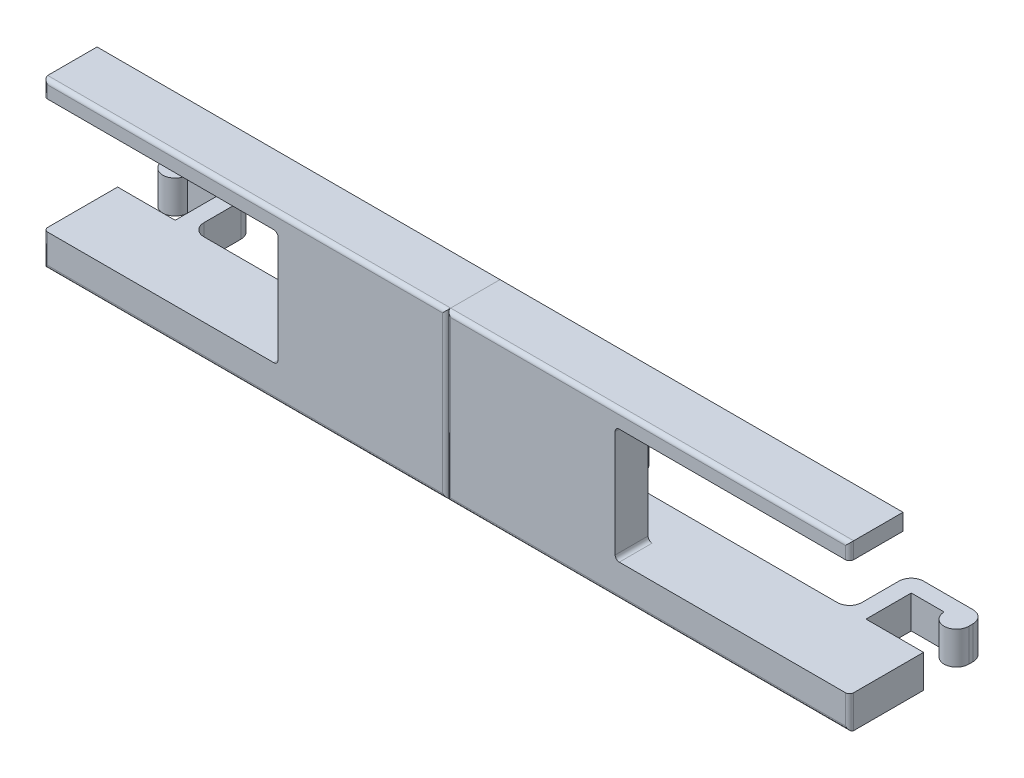
from build123d import *

# Parameters (mm, degrees)
EXTRUDE_1_DEPTH = 4
FILLET_1_R      = 1.5
EXTRUDE_2_DEPTH = 14
SKETCH_3_W      = 49
SKETCH_3_H      = 6.5
EXTRUDE_3_DEPTH = 2
FILLET_2_R      = 0.5
FILLET_3_R      = 1.5


with BuildPart() as part:
    # 草图1 → 凸台-拉伸1 (new body)
    with BuildSketch(Plane(origin=(0, 0, 0), x_dir=(1, 0, 0), z_dir=(0, 1, 0))):
        with BuildLine():
            Line((-34.254247299, 7.776879268), (-41.254247299, 7.776879268))
            Line((-41.254247299, 7.776879268), (-41.254247299, -1.223120732))
            Line((-41.254247299, -1.223120732), (7.745752701, -1.223120732))
            Line((7.745752701, -1.223120732), (7.745752701, 7.776879268))
            Line((7.745752701, 7.776879268), (7.745752701, 12.776879268))
            Line((7.745752701, 12.776879268), (7.745752701, 15.276879268))
            Line((7.745752701, 15.276879268), (5.745752701, 15.276879268))
            Line((5.745752701, 15.276879268), (-1.254247299, 15.276879268))
            Line((-1.254247299, 15.276879268), (-1.254247299, 13.276879268))
            ThreePointArc((-1.254247299, 13.276879268), (0.245752701, 11.776879268), (1.745752701, 13.276879268))
            Line((1.745752701, 13.276879268), (5.745752701, 13.276879268))
            Line((5.745752701, 13.276879268), (5.745752701, 7.776879268))
            Line((5.745752701, 7.776879268), (-32.254247299, 7.776879268))
            Line((-32.254247299, 7.776879268), (-32.254247299, 15.276879268))
            Line((-32.254247299, 15.276879268), (-34.254247299, 15.276879268))
            Line((-34.254247299, 15.276879268), (-41.254247299, 15.276879268))
            Line((-41.254247299, 15.276879268), (-41.254247299, 13.276879268))
            ThreePointArc((-41.254247299, 13.276879268), (-39.754247299, 11.776879268), (-38.254247299, 13.276879268))
            Line((-38.254247299, 13.276879268), (-34.254247299, 13.276879268))
            Line((-34.254247299, 13.276879268), (-34.254247299, 7.776879268))
        make_face()
    extrude(amount=EXTRUDE_1_DEPTH)

    # 圆角1
    fillet_1_edges = [part.edges().sort_by_distance(p)[0] for p in [
        (-41.254247299, 2, -15.276879268),
        (-32.254247299, 2, -15.276879268),
        (-1.254247299, 2, -15.276879268),
        (7.745752701, 2, -15.276879268),
    ]]
    fillet(fillet_1_edges, radius=FILLET_1_R)

    # 草图2 → 凸台-拉伸2 (add)
    with BuildSketch(Plane(origin=(0, 4, 0), x_dir=(1, 0, 0), z_dir=(0, 1, 0))):
        Polygon((7.745752701, -1.223120732), (-0.754247299, -1.223120732), (-12.754247299, -1.223120732), (-12.754247299, 2.776879268), (-0.754247299, 2.776879268), (-0.754247299, 5.276879268), (7.745752701, 5.276879268), align=None)
    extrude(amount=EXTRUDE_2_DEPTH)

    # 草图3 → 凸台-拉伸3 (add)
    with BuildSketch(Plane(origin=(0, 18, 0), x_dir=(1, 0, 0), z_dir=(0, 1, 0))):
        with Locations((-16.754247299, 2.026879268)):
            Rectangle(SKETCH_3_W, SKETCH_3_H)
    extrude(amount=EXTRUDE_3_DEPTH)

    # 圆角2
    fillet_2_edges = [part.edges().sort_by_distance(p)[0] for p in [
        (-0.754247299, 11, -2.776879268),
        (-12.754247299, 4, -0.776879268),
        (-12.754247299, 18, -0.776879268),
        (-41.254247299, 19, 1.223120732),
        (-16.754247299, 20, 1.223120732),
        (-16.754247299, 0, 1.223120732),
        (7.745752701, 10, 1.223120732),
        (-41.254247299, 2, 1.223120732),
    ]]
    fillet(fillet_2_edges, radius=FILLET_2_R)

    # 圆角3
    fillet_3_edges = [part.edges().sort_by_distance(p)[0] for p in [
        (-32.254247299, 2, -7.776879268),
    ]]
    fillet(fillet_3_edges, radius=FILLET_3_R)


with BuildPart() as body_2:
    # 镜向1: mirrored copy
    add(part.part.mirror(Plane(origin=(7.745752701, 4, 0), x_dir=(0, 0, 1), z_dir=(1, 0, 0))))


solid = Compound([part.part, body_2.part])
